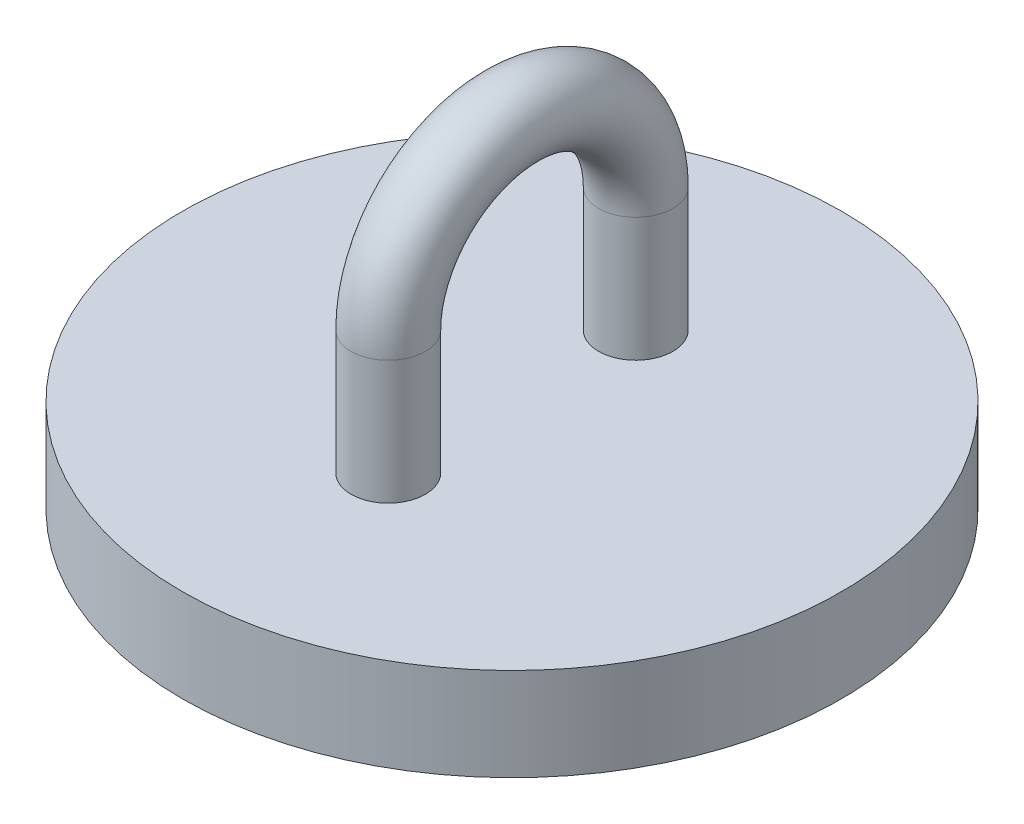
from build123d import *

# Parameters (mm, degrees)
SKETCH1_R           = 10.65
BOSS_EXTRUDE1_DEPTH = 3
SKETCH2_R           = 1.2


with BuildPart() as part:
    # Sketch1 → Boss-Extrude1 (new body)
    with BuildSketch(Plane(origin=(0, 0, 0), x_dir=(1, 0, 0), z_dir=(0, 1, 0))):
        with Locations(Location((0, 0, 0), (0, 0, 270))):
            Circle(SKETCH1_R)
    extrude(amount=BOSS_EXTRUDE1_DEPTH)

    # Sweep1: sweep along a path in Sketch3
    with BuildLine(Plane(origin=(0, 0, 0), x_dir=(0, 0, -1), z_dir=(1, 0, 0))) as sweep1_path:
        Line((-4, 3), (-4, 7))
        ThreePointArc((-4, 7), (0, 11), (4, 7))
        Line((4, 7), (4, 3))
    # Sketch2 → Sweep1 (sweep)
    with BuildSketch(Plane(origin=(0, 3, 0), x_dir=(1, 0, 0), z_dir=(0, 1, 0))):
        with Locations((0, -4)):
            Circle(SKETCH2_R)
    sweep(path=sweep1_path.line)


solid = part.part
